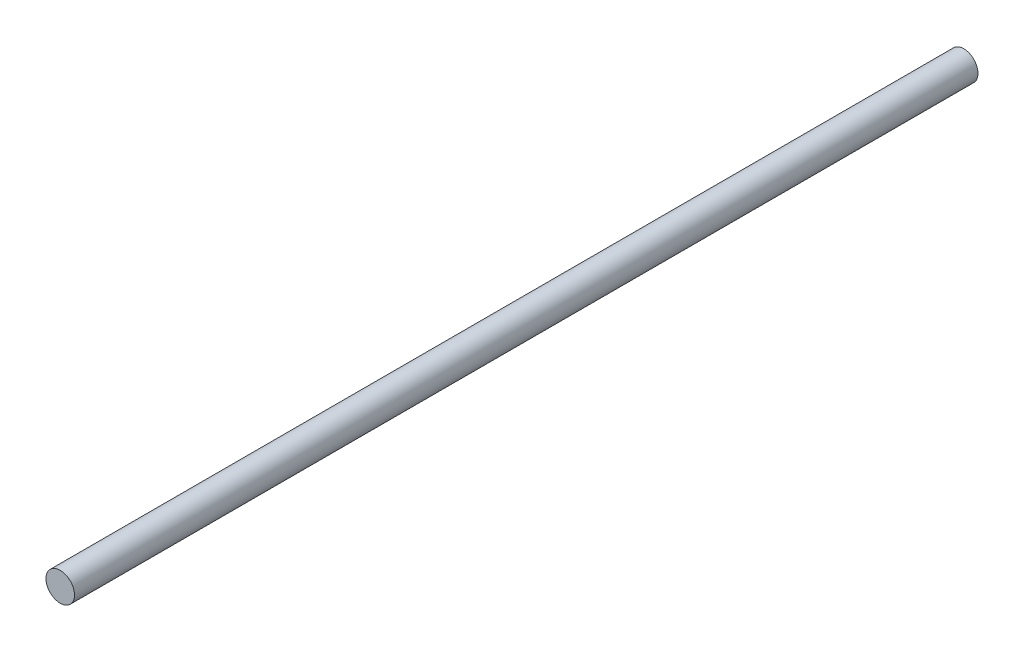
from build123d import *

# Parameters (mm, degrees)
SKETCH_1_R      = 3
EXTRUDE_1_DEPTH = 190


with BuildPart() as part:
    # 草图1 → 凸台-拉伸1 (new body)
    with BuildSketch(Plane.XY):
        Circle(SKETCH_1_R)
    extrude(amount=EXTRUDE_1_DEPTH)


solid = part.part
